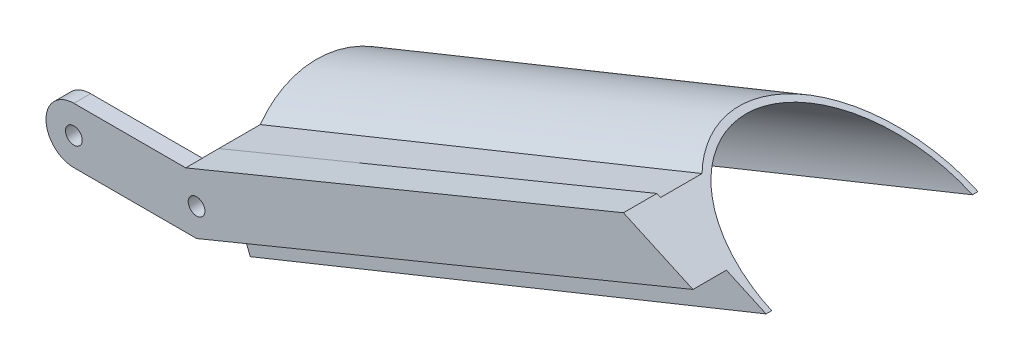
from build123d import *

# Parameters (mm, degrees)
SKETCH1_R           = 1.5
BOSS_EXTRUDE1_DEPTH = 3
EXTRUDE_1_DEPTH     = 3
EXTRUDE_2_DEPTH     = 3
EXTRUDE_3_REACH     = 100.745


with BuildPart() as part:
    # Sketch1 → Boss-Extrude1 (new body)
    # profile 1 of 2: a face of its own
    with BuildSketch(Plane.XY):
        with BuildLine():
            Line((20.05, 5), (0, 5))
            ThreePointArc((0, 5), (-5, 0), (0, -5))
            Line((0, -5), (22, -5))
            Line((22, -5), (25.516973514, -3.553997369))
            ThreePointArc((25.516973514, -3.553997369), (26.624391141, 1.901317064), (22, 5))
            Line((22, 5), (20.05, 5))
        make_face()
        Circle(SKETCH1_R, mode=Mode.SUBTRACT)
        with Locations((22, 0)):
            Circle(SKETCH1_R, mode=Mode.SUBTRACT)
    # profile 2 of 2: a face of its own
    with BuildSketch(Plane.XY):
        with BuildLine():
            Line((46.409029503, 15.837507263), (20.05, 5))
            Line((20.05, 5), (22, 5))
            ThreePointArc((22, 5), (26.624391141, 1.901317064), (25.516973514, -3.553997369))
            Line((25.516973514, -3.553997369), (48.359029503, 5.837507263))
            Line((48.359029503, 5.837507263), (58.872830999, 10.16025367))
            Line((58.872830999, 10.16025367), (53.359871826, 12.67140304))
            Line((53.359871826, 12.67140304), (46.409029503, 15.837507263))
        make_face()
    extrude(amount=BOSS_EXTRUDE1_DEPTH)

    # 草图1 → 凸台-拉伸1 (add)
    with BuildSketch(Plane.XY.offset(3)):
        Polygon((46.409029503, 15.837507263), (58.872830999, 10.16025367), (111.008388469, 31.59577286), (98.544586973, 37.273026453), align=None)
    extrude(amount=-EXTRUDE_1_DEPTH)

    # 草图4 → 凸台-拉伸2 (add)
    with BuildSketch(Plane(origin=(0, 0, 0), x_dir=(-1, 0, 0), z_dir=(0, 0, -1))):
        with BuildLine():
            Line((-111.008388469, 31.59577286), (-98.544586973, 37.273026453))
            Line((-98.544586973, 37.273026453), (-19.990187018, 4.97540791))
            Line((-19.990187018, 4.97540791), (-21.063636635, 2.318021494))
            ThreePointArc((-21.063636635, 2.318021494), (-24.318021494, 0.936363365), (-22.936363365, -2.318021494))
            Line((-22.936363365, -2.318021494), (-23.732077199, -4.287856967))
            Line((-23.732077199, -4.287856967), (-111.008388469, 31.59577286))
        make_face()
    extrude(amount=EXTRUDE_2_DEPTH)

    # 凸台-拉伸3: up to this plane
    extrude_3_end = Plane(origin=(98.544586973, 37.273026453, -70.058401543), z_dir=(0.4145222599320868, 0.9100391727946636, 0))
    # 草图5 → 凸台-拉伸3 (add, up to the surface)
    with BuildSketch(Plane(origin=(18.913747244, 7.640196631, 0), x_dir=(0.3745453459539944, -0.9272085977945863, 0), z_dir=(-0.9272085977945863, -0.3745453459539944, 0)), mode=Mode.PRIVATE) as extrude_3_sk1:
        with BuildLine():
            Line((17.949999281, -3), (17.949999281, -4))
            ThreePointArc((17.949999281, -4), (-0.050000719, -22), (17.949999281, -40))
            Line((17.949999281, -40), (17.949999281, -41))
            ThreePointArc((17.949999281, -41), (0.910251194, -30.405176091), (2.873990521, -10.43652475))
            Line((2.873990521, -10.43652475), (2.873990521, -3))
            Line((2.873990521, -3), (17.949999281, -3))
        make_face()
    extrude_3_tool1 = split(extrude(extrude_3_sk1.sketch, amount=-EXTRUDE_3_REACH, mode=Mode.PRIVATE), bisect_by=extrude_3_end, keep=Keep.BOTH, mode=Mode.PRIVATE)
    add(extrude_3_tool1.solids().sort_by_distance((20.149314, 4.581481, -6.718262))[0])


solid = part.part
